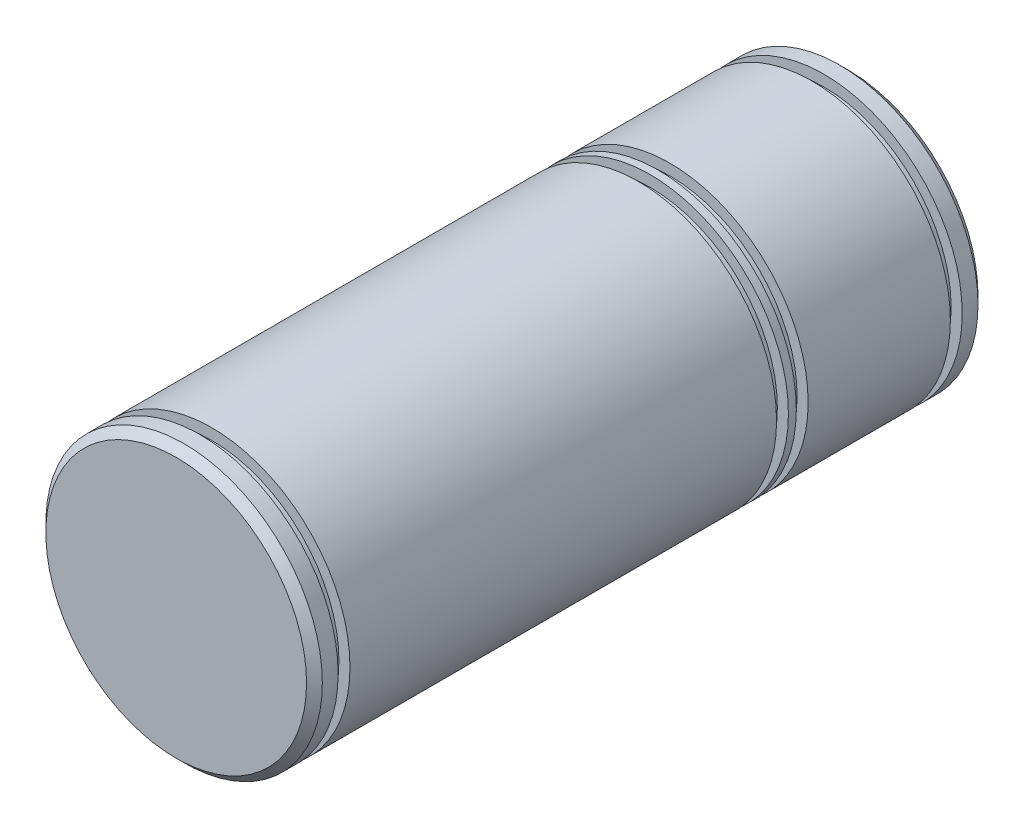
from build123d import *

# Parameters (mm, degrees)
SKETCH1_R     = 17.5
BODY_DEPTH    = 85
SKETCH2_W     = 1.5
SKETCH2_H     = 1.4
CHAMFER1_SIZE = 1


with BuildPart() as part:
    # Sketch1 → Body (new body)
    with BuildSketch(Plane.XY):
        Circle(SKETCH1_R)
    extrude(amount=BODY_DEPTH)

    # Sketch2 → Ret Ring Grooves (revolve, cut)
    with BuildSketch(Plane(origin=(0, 0, 0), x_dir=(0, 0, -1), z_dir=(1, 0, 0)), mode=Mode.PRIVATE) as ret_ring_grooves_sk:
        with Locations((-3.75, 16.8)):
            Rectangle(SKETCH2_W, SKETCH2_H)
        with Locations((-23.25, 16.8)):
            Rectangle(SKETCH2_W, SKETCH2_H)
        with Locations((-25.75, 16.8)):
            Rectangle(SKETCH2_W, SKETCH2_H)
        with Locations((-81.25, 16.8)):
            Rectangle(SKETCH2_W, SKETCH2_H)
    revolve(ret_ring_grooves_sk.sketch.rotate(Axis((0, 0, 85), (0, 0, -1)), 90), axis=Axis((0, 0, 85), (0, 0, -1)), mode=Mode.SUBTRACT)

    # Chamfer1
    chamfer1_edges = [part.edges().sort_by_distance(p)[0] for p in [
        (-17.5, 0, 0),
        (-17.5, 0, 85),
    ]]
    chamfer(chamfer1_edges, length=CHAMFER1_SIZE)


solid = part.part
